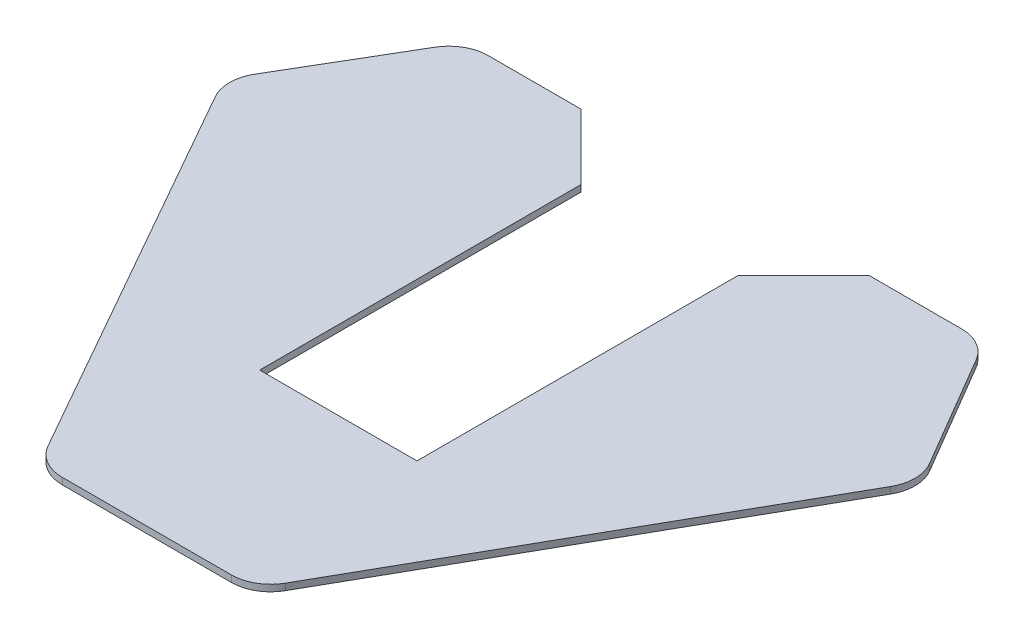
from build123d import *

# Parameters (mm, degrees)
EXTRUDE_1_DEPTH          = 5
CUT_EXTRUDE_1_DEPTH      = 373.886350983
CUT_EXTRUDE_1_DEPTH_BACK = 373.886350983
CUT_EXTRUDE_2_REACH      = 374.886
SKETCH_4_W               = 120
SKETCH_4_H               = 360
FILLET_1_R               = 30


with BuildPart() as part:
    # 草图2 → 凸台-拉伸1 (new body)
    with BuildSketch(Plane(origin=(0, 0, 0), x_dir=(1, 0, 0), z_dir=(0, 1, 0))):
        Polygon((-197.790744863, 180), (-266.129914045, 63.779122951), (-81.97, -261.14), (81.97, -261.14), (266.129914045, 63.779122951), (197.790744863, 180), align=None)
    extrude(amount=EXTRUDE_1_DEPTH)

    # 草图3 → 切除-拉伸1 (cut, two sides: drawn at the far end of the back side and taken through both)
    with BuildSketch(Plane(origin=(0, 5, 0), x_dir=(1, 0, 0), z_dir=(0, 1, 0)).offset(-CUT_EXTRUDE_1_DEPTH_BACK)):
        Polygon((25, 95), (110, 180), (-110, 180), (-25, 95), align=None)
    extrude(amount=CUT_EXTRUDE_1_DEPTH + CUT_EXTRUDE_1_DEPTH_BACK, mode=Mode.SUBTRACT)

    # 草图4 → 切除-拉伸2 (cut, up to next)
    with BuildSketch(Plane(origin=(0, 5, 0), x_dir=(1, 0, 0), z_dir=(0, 1, 0)), mode=Mode.PRIVATE) as cut_extrude_2_sk1:
        with Locations((0, 65)):
            Rectangle(SKETCH_4_W, SKETCH_4_H)
    cut_extrude_2_tool1 = extrude(cut_extrude_2_sk1.sketch, amount=-CUT_EXTRUDE_2_REACH, mode=Mode.PRIVATE) & part.part
    add(cut_extrude_2_tool1.solids().sort_by_distance((0, 5, -65))[0], mode=Mode.SUBTRACT)

    # 圆角1
    fillet_1_edges = [part.edges().sort_by_distance(p)[0] for p in [
        (197.790744863, 2.5, -180),
        (266.129914045, 2.5, -63.779122951),
        (81.97, 2.5, 261.14),
        (-81.97, 2.5, 261.14),
        (-266.129914045, 2.5, -63.779122951),
        (-197.790744863, 2.5, -180),
    ]]
    fillet(fillet_1_edges, radius=FILLET_1_R)


solid = part.part
